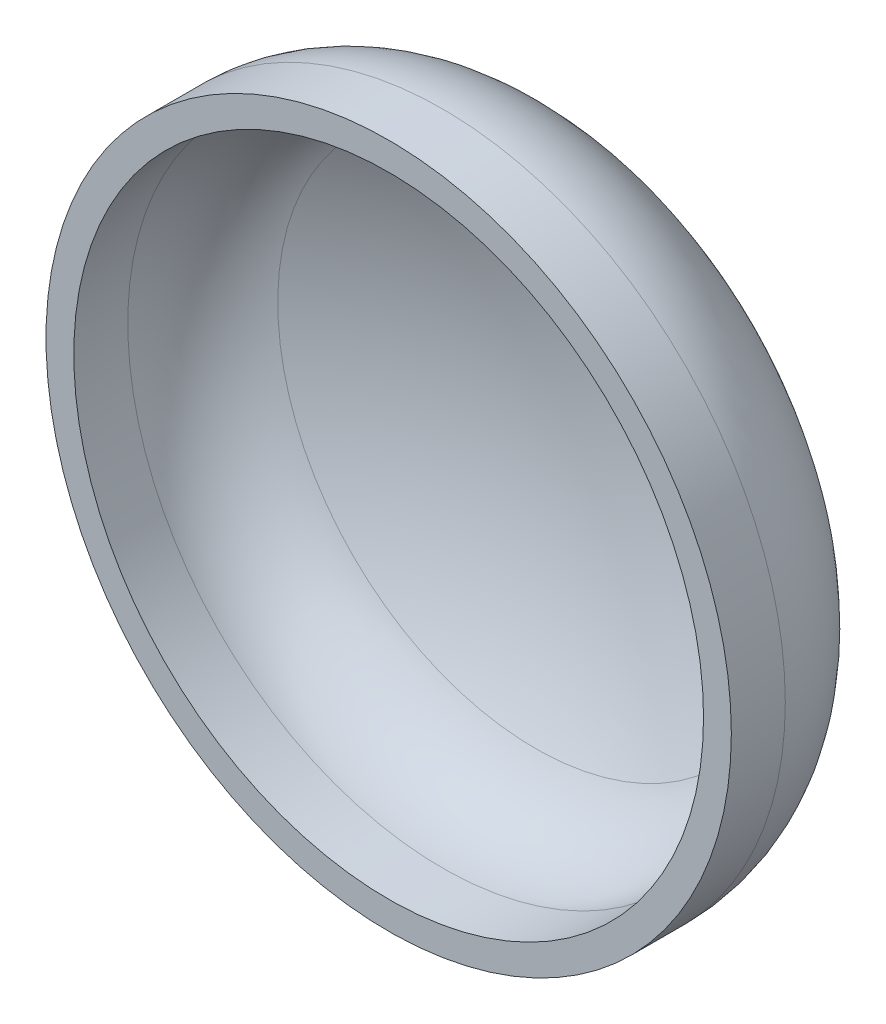
from build123d import *


with BuildPart() as part:
    # Sketch1 → Revolve1 (revolve)
    with BuildSketch(Plane(origin=(0, 0, 0), x_dir=(0, 0, -1), z_dir=(1, 0, 0)), mode=Mode.PRIVATE) as revolve1_sk:
        with BuildLine():
            Line((0, 254), (40, 254))
            ThreePointArc((40, 254), (91.208605599, 239.486934669), (127.187829259, 200.263908046))
            ThreePointArc((127.187829259, 200.263908046), (162.678124968, 102.914345416), (174.725362887, 0))
            Line((174.725362887, 0), (154.125362887, 0))
            ThreePointArc((154.125362887, 0), (142.635066398, 98.156635551), (108.785480051, 191.005747126))
            ThreePointArc((108.785480051, 191.005747126), (80.400231876, 221.95014313), (40, 233.4))
            Line((40, 233.4), (0, 233.4))
            Line((0, 233.4), (0, 254))
        make_face()
    revolve(revolve1_sk.sketch.rotate(Axis((0, 0, 0), (0, 0, -1)), 90), axis=Axis((0, 0, 0), (0, 0, -1)))


solid = part.part
